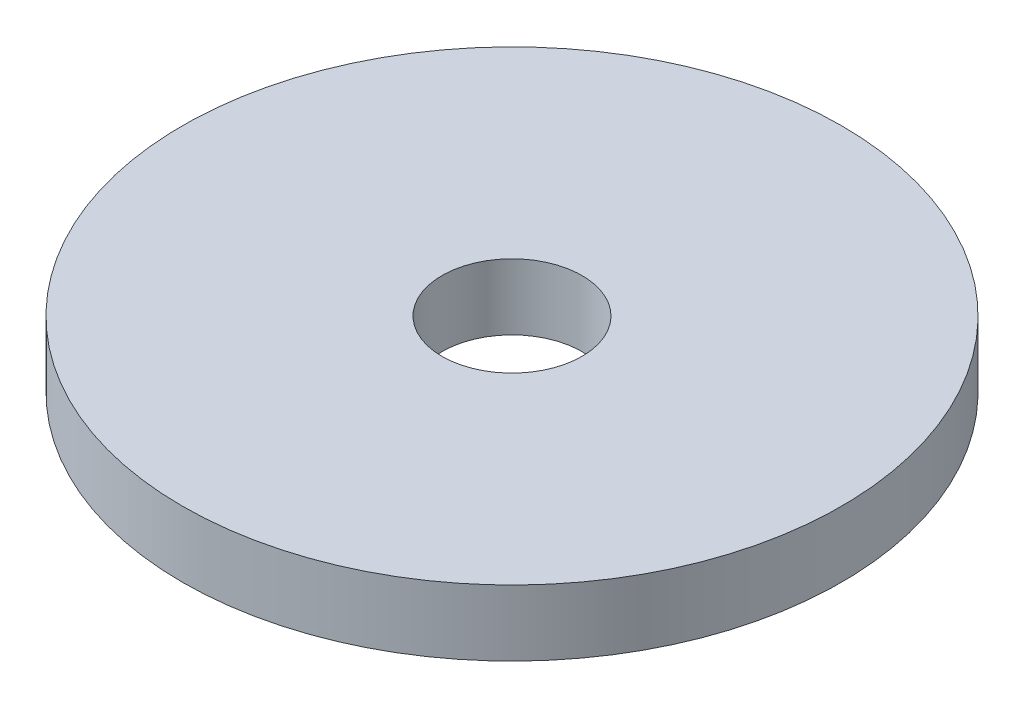
from build123d import *

# Parameters (mm, degrees)
SKETCH_1_R      = 10
SKETCH_1_R_2    = 2.125
EXTRUDE_1_DEPTH = 2


with BuildPart() as part:
    # 草图1 → 凸台-拉伸1 (new body)
    with BuildSketch(Plane(origin=(0, 0, 0), x_dir=(1, 0, 0), z_dir=(0, 1, 0))):
        with Locations(Location((0, 0, 0), (0, 0, 270))):
            Circle(SKETCH_1_R)
        with Locations(Location((0, 0, 0), (0, 0, 270))):
            Circle(SKETCH_1_R_2, mode=Mode.SUBTRACT)
    extrude(amount=EXTRUDE_1_DEPTH)


solid = part.part
